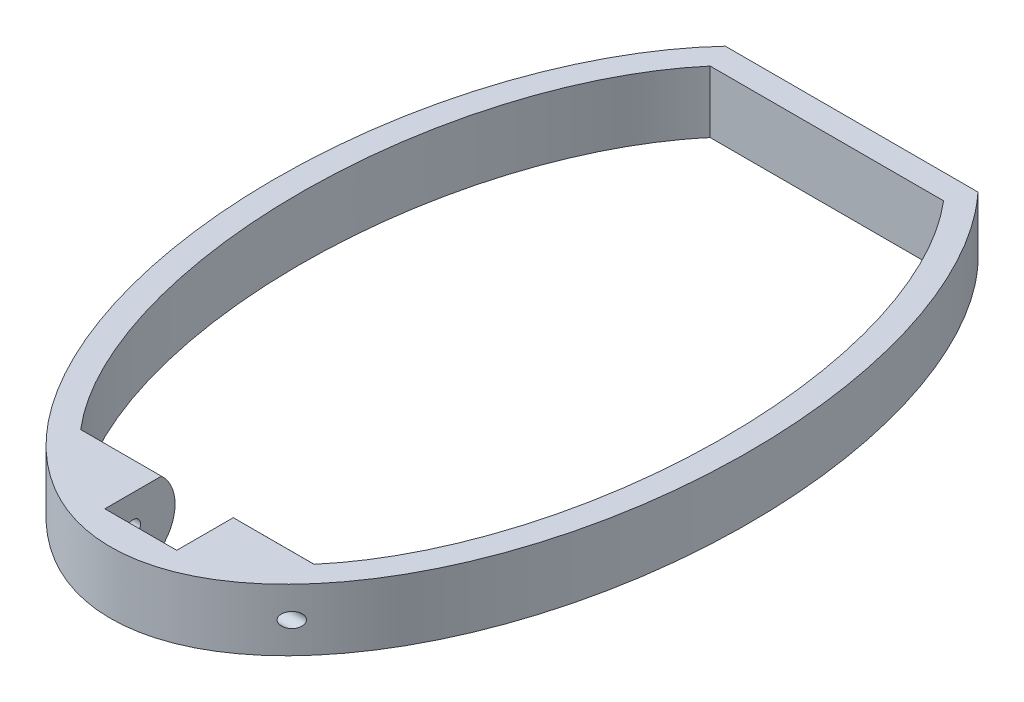
from build123d import *

# Parameters (mm, degrees)
BOSS_EXTRUDE2_DEPTH      = 6.35
CUT_EXTRUDE18_DEPTH      = 49.185915618
CUT_EXTRUDE18_DEPTH_BACK = 49.185915618
SKETCH37_R               = 0.762
BOSS_EXTRUDE3_REACH      = 52.141
BOSS_EXTRUDE4_REACH      = 52.141
SKETCH42_W               = 1.696048547
SKETCH42_H               = 6.35
BOSS_EXTRUDE5_DEPTH      = 7.366
SKETCH43_R               = 4.298393504
CUT_EXTRUDE19_DEPTH      = 7.366


with BuildPart() as part:
    # Sketch36 → Boss-Extrude2 (new body)
    with BuildSketch(Plane(origin=(0, 0, 0), x_dir=(1, 0, 0), z_dir=(0, 1, 0))):
        with BuildLine():
            Line((-12.945627945, 34.798), (12.945899189, 34.798))
            add(Edge.make_bspline(
                [(-12.945627945, 34.798), (-83.888708787, -41.147999955), (-0.000160371, -41.147999955), (83.888388045, -41.147999955), (12.945899189, 34.798)],
                knots=[0.562963666, 0.562963666, 0.562963666, 3.141596175, 3.141596175, 5.720228684, 5.720228684, 5.720228684], degree=2, weights=[1, 0.277777777, 1, 0.277777777, 1]))
        make_face()
        with BuildLine():
            Line((-3.683, -32.258), (-3.683, -38.053019143))
            add(Edge.make_bspline(
                [(-3.683, -38.053019143), (-2.482090688, -38.417731108), (-1.258384389, -38.606958819), (0.301808084, -38.608254983), (0.616446755, -38.596527307), (1.240326077, -38.549447356), (1.550254263, -38.514179279), (2.474180823, -38.37421942), (3.082332805, -38.235439673), (3.683, -38.053019143)],
                knots=[0, 0, 0, 0, 0.5, 0.5, 0.625, 0.625, 0.75, 0.75, 1, 1, 1, 1], degree=3))
            Line((3.683, -38.053019143), (3.683, -32.258))
            Line((3.683, -32.258), (11.959166509, -32.258))
            add(Edge.make_bspline(
                [(11.959166509, -32.258), (12.900842466, -31.156491085), (13.738452503, -29.992146986), (15.259350973, -27.570279131), (15.94194291, -26.312334831), (16.870001904, -24.367556715), (17.163854304, -23.708077916), (17.718474432, -22.378531672), (17.978852397, -21.709655523), (18.713928581, -19.69186626), (19.142827541, -18.33185496), (20.271201588, -14.213455885), (20.814329883, -11.41718178), (21.357935276, -7.157080152), (21.493423806, -5.722094882), (21.672587527, -2.861720676), (21.716837187, -1.433721974), (21.717324285, 2.843889226), (21.543010859, 5.687199416), (21.004187459, 9.938775543), (20.777820937, 11.354414051), (20.223680311, 14.177922557), (19.898355991, 15.573551478), (19.143536874, 18.329998044), (18.71413188, 19.6908457), (17.737325451, 22.37310943), (17.190129963, 23.694594327), (16.262710189, 25.641189638), (15.934875145, 26.285471682), (15.245025968, 27.549383152), (14.882707738, 28.169873501), (13.737968871, 29.993254889), (12.898877146, 31.158789984), (11.959166509, 32.258)],
                knots=[0, 0, 0, 0, 0.0625, 0.0625, 0.125, 0.125, 0.15625, 0.15625, 0.1875, 0.1875, 0.25, 0.25, 0.375, 0.375, 0.4375, 0.4375, 0.5, 0.5, 0.625, 0.625, 0.6875, 0.6875, 0.75, 0.75, 0.8125, 0.8125, 0.875, 0.875, 0.90625, 0.90625, 0.9375, 0.9375, 1, 1, 1, 1], degree=3))
            Line((11.959166509, 32.258), (-11.959166509, 32.258))
            add(Edge.make_bspline(
                [(-11.959166509, 32.258), (-12.900842466, 31.156491085), (-13.738452503, 29.992146986), (-15.259350973, 27.570279131), (-15.94194291, 26.312334831), (-16.870001904, 24.367556715), (-17.163854304, 23.708077916), (-17.718474432, 22.378531672), (-17.978852397, 21.709655523), (-18.713928581, 19.69186626), (-19.142827541, 18.33185496), (-20.271201588, 14.213455885), (-20.814329883, 11.41718178), (-21.357935276, 7.157080152), (-21.493423806, 5.722094882), (-21.672587527, 2.861720676), (-21.716837187, 1.433721974), (-21.717324285, -2.843889226), (-21.543010859, -5.687199416), (-21.004187459, -9.938775543), (-20.777820937, -11.354414051), (-20.223680311, -14.177922557), (-19.898355991, -15.573551478), (-19.143536874, -18.329998044), (-18.71413188, -19.6908457), (-17.737325451, -22.37310943), (-17.190129963, -23.694594327), (-16.262710189, -25.641189638), (-15.934875145, -26.285471682), (-15.245025968, -27.549383152), (-14.882707738, -28.169873501), (-13.737968871, -29.993254889), (-12.898877146, -31.158789984), (-11.959166509, -32.258)],
                knots=[0, 0, 0, 0, 0.0625, 0.0625, 0.125, 0.125, 0.15625, 0.15625, 0.1875, 0.1875, 0.25, 0.25, 0.375, 0.375, 0.4375, 0.4375, 0.5, 0.5, 0.625, 0.625, 0.6875, 0.6875, 0.75, 0.75, 0.8125, 0.8125, 0.875, 0.875, 0.90625, 0.90625, 0.9375, 0.9375, 1, 1, 1, 1], degree=3))
            Line((-11.959166509, -32.258), (-3.683, -32.258))
        make_face(mode=Mode.SUBTRACT)
    extrude(amount=BOSS_EXTRUDE2_DEPTH)

    # Sketch37 → Cut-Extrude18 (cut, two sides: drawn at the far end of the back side and taken through both)
    with BuildSketch(Plane(origin=(0, 0, 0), x_dir=(0, 0, -1), z_dir=(1, 0, 0)).offset(-CUT_EXTRUDE18_DEPTH_BACK)):
        with Locations((-35.155509572, 3.175)):
            Circle(SKETCH37_R)
    extrude(amount=CUT_EXTRUDE18_DEPTH + CUT_EXTRUDE18_DEPTH_BACK, mode=Mode.SUBTRACT)

    # Sketch40 → Boss-Extrude3 (add, up to next)
    with BuildSketch(Plane.ZY.offset(-3.683), mode=Mode.PRIVATE) as boss_extrude3_sk1:
        with BuildLine():
            Line((32.258, 0), (32.258, 6.35))
            ThreePointArc((32.258, 6.35), (30.857116067, 3.175), (32.258, 0))
        make_face()
    boss_extrude3_tool1 = extrude(boss_extrude3_sk1.sketch, amount=-BOSS_EXTRUDE3_REACH, mode=Mode.PRIVATE) - part.part
    add(boss_extrude3_tool1.solids().sort_by_distance((3.683, 3.175, 31.688999))[0])

    # Sketch41 → Boss-Extrude4 (add, up to next)
    with BuildSketch(Plane(origin=(-3.683, 0, 0), x_dir=(0, 0, -1), z_dir=(1, 0, 0)), mode=Mode.PRIVATE) as boss_extrude4_sk1:
        with BuildLine():
            Line((-32.258, 0), (-32.258, 6.35))
            ThreePointArc((-32.258, 6.35), (-30.857116067, 3.175), (-32.258, 0))
        make_face()
    boss_extrude4_tool1 = extrude(boss_extrude4_sk1.sketch, amount=-BOSS_EXTRUDE4_REACH, mode=Mode.PRIVATE) - part.part
    add(boss_extrude4_tool1.solids().sort_by_distance((-3.683, 3.175, 31.688999))[0])

    # Sketch42 → Boss-Extrude5 (add)
    with BuildSketch(Plane.ZY.offset(-3.683)):
        with Locations((38.901043417, 3.175)):
            Rectangle(SKETCH42_W, SKETCH42_H)
    extrude(amount=BOSS_EXTRUDE5_DEPTH)

    # Sketch43 → Cut-Extrude19 (cut)
    with BuildSketch(Plane.ZY.offset(-3.683)):
        with Locations((35.155509572, 3.175)):
            Circle(SKETCH43_R)
    extrude(amount=CUT_EXTRUDE19_DEPTH, mode=Mode.SUBTRACT)


solid = part.part
